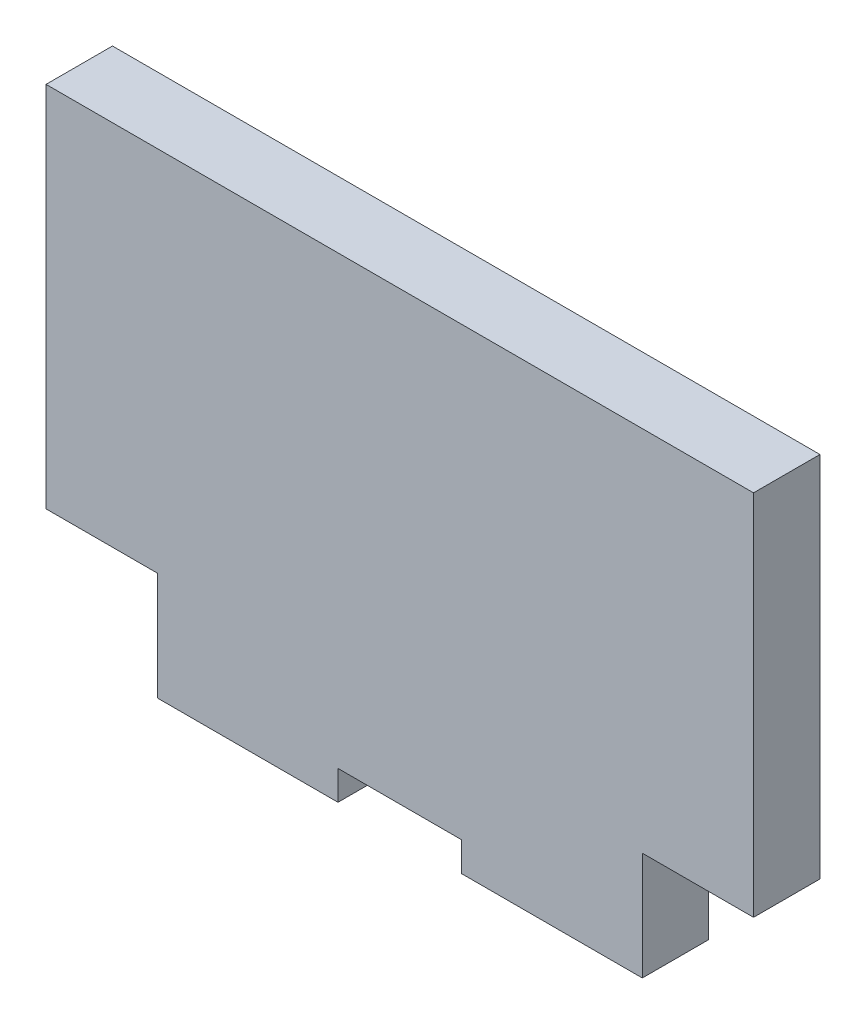
from build123d import *

# Parameters (mm, degrees)
BOSS_EXTRUDE1_DEPTH = 4.3
SKETCH3_W           = 8
SKETCH3_H           = 2
CUT_EXTRUDE1_DEPTH  = 4.3
SKETCH4_W           = 11
SKETCH4_H           = 12
CUT_EXTRUDE2_DEPTH  = 3.3


with BuildPart() as part:
    # Sketch2 → Boss-Extrude1 (new body)
    with BuildSketch(Plane.XY):
        Polygon((4, -15.4), (-15.7, -15.4), (-15.7, -8.4), (-22.9, -8.4), (-22.9, 15.4), (22.9, 15.4), (22.9, -8.4), (15.7, -8.4), (15.7, -15.4), align=None)
    extrude(amount=-BOSS_EXTRUDE1_DEPTH)

    # Sketch3 → Cut-Extrude1 (cut)
    with BuildSketch(Plane.XY):
        with Locations((0, -14.5)):
            Rectangle(SKETCH3_W, SKETCH3_H)
    extrude(amount=-CUT_EXTRUDE1_DEPTH, mode=Mode.SUBTRACT)

    # Sketch4 → Cut-Extrude2 (cut)
    with BuildSketch(Plane(origin=(0, 0, -4.3), x_dir=(-1, 0, 0), z_dir=(0, 0, -1))):
        with Locations((0, -7.5)):
            Rectangle(SKETCH4_W, SKETCH4_H)
    extrude(amount=-CUT_EXTRUDE2_DEPTH, mode=Mode.SUBTRACT)


solid = part.part
